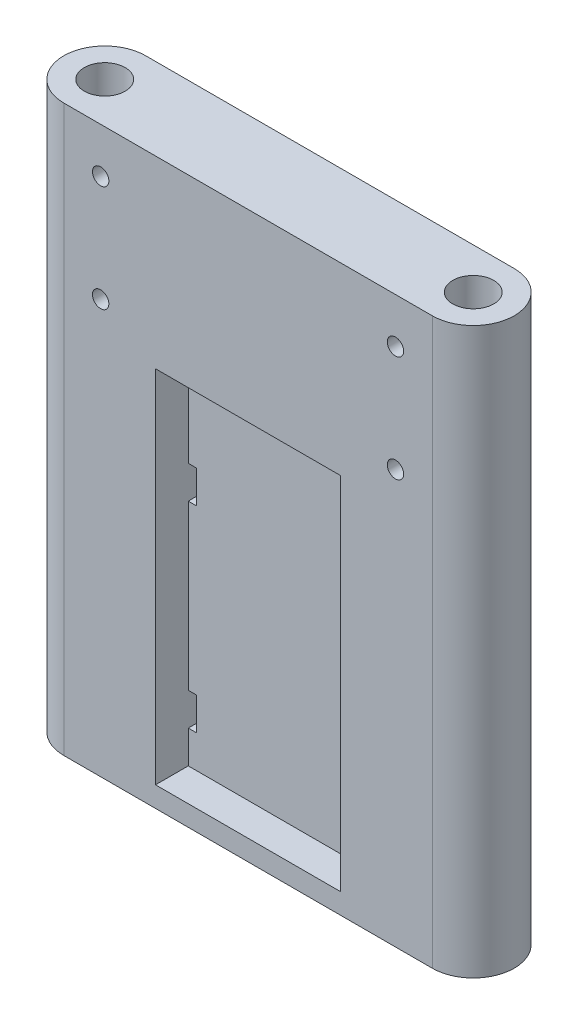
from build123d import *

# Parameters (mm, degrees)
SKETCH2_R           = 3.175
BOSS_EXTRUDE1_DEPTH = 43.815
SKETCH5_R           = 1.27
CUT_EXTRUDE1_DEPTH  = 5.08
SKETCH6_R           = 1.27
CUT_EXTRUDE2_DEPTH  = 58.452587844
SKETCH7_W           = 28.702
SKETCH7_H           = 55.88
CUT_EXTRUDE3_DEPTH  = 5.08
SKETCH8_W           = 1.27
SKETCH8_H           = 5.08
CUT_EXTRUDE4_DEPTH  = 57.547097627


with BuildPart() as part:
    # Sketch2 → Boss-Extrude1 (new, symmetric)
    with BuildSketch(Plane(origin=(0, 0, 0), x_dir=(1, 0, 0), z_dir=(0, 1, 0))):
        with BuildLine():
            Line((-28.575, 6.35), (28.575, 6.35))
            ThreePointArc((28.575, 6.35), (34.925, 0), (28.575, -6.35))
            Line((28.575, -6.35), (-28.575, -6.35))
            ThreePointArc((-28.575, -6.35), (-34.925, 0), (-28.575, 6.35))
        make_face()
        with Locations(Location((28.575, 0, 0), (0, 0, 270))):
            Circle(SKETCH2_R, mode=Mode.SUBTRACT)
        with Locations(Location((-28.575, 0, 0), (0, 0, 270))):
            Circle(SKETCH2_R, mode=Mode.SUBTRACT)
    extrude(amount=BOSS_EXTRUDE1_DEPTH, both=True)

    # Sketch5 → Cut-Extrude1 (cut)
    with BuildSketch(Plane(origin=(0, 0, -6.35), x_dir=(-1, 0, 0), z_dir=(0, 0, -1))):
        with Locations((22.86, 36.83)):
            Circle(SKETCH5_R)
        with Locations((22.86, 20.32)):
            Circle(SKETCH5_R)
        with Locations((-22.86, 36.83)):
            Circle(SKETCH5_R)
        with Locations((-22.86, 20.32)):
            Circle(SKETCH5_R)
    extrude(amount=-CUT_EXTRUDE1_DEPTH, mode=Mode.SUBTRACT)

    # Sketch6 → Cut-Extrude2 (cut, through all)
    with BuildSketch(Plane.XY.offset(6.35)):
        with Locations(Location((22.86, 36.83, 0), (0, 0, 180))):
            Circle(SKETCH6_R)
        with Locations(Location((22.86, 20.32, 0), (0, 0, 180))):
            Circle(SKETCH6_R)
        with Locations(Location((-22.86, 36.83, 0), (0, 0, 180))):
            Circle(SKETCH6_R)
        with Locations(Location((-22.86, 20.32, 0), (0, 0, 180))):
            Circle(SKETCH6_R)
    extrude(amount=-CUT_EXTRUDE2_DEPTH, mode=Mode.SUBTRACT)

    # Sketch7 → Cut-Extrude3 (cut)
    with BuildSketch(Plane.XY.offset(6.35)):
        with Locations((0, -12.7)):
            Rectangle(SKETCH7_W, SKETCH7_H)
    cut_extrude3 = extrude(amount=-CUT_EXTRUDE3_DEPTH, mode=Mode.SUBTRACT)

    # Mirror1: Cut-Extrude3 across plane
    add(cut_extrude3.mirror(Plane.XY), mode=Mode.SUBTRACT)

    # Sketch8 → Cut-Extrude4 (cut, through all)
    with BuildSketch(Plane.XY.offset(1.27)):
        with Locations((13.716, -33.02)):
            Rectangle(SKETCH8_W, SKETCH8_H)
        with Locations((13.716, -2.54)):
            Rectangle(SKETCH8_W, SKETCH8_H)
    cut_extrude4 = extrude(amount=-CUT_EXTRUDE4_DEPTH, mode=Mode.SUBTRACT)

    # Mirror2: Cut-Extrude4 across plane
    add(cut_extrude4.mirror(Plane(origin=(0, 0, 0), x_dir=(0, 0, 1), z_dir=(1, 0, 0))), mode=Mode.SUBTRACT)


solid = part.part
